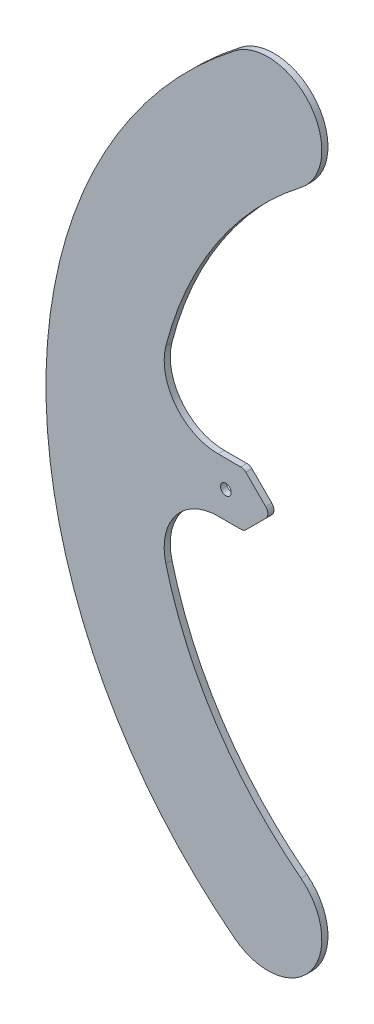
from build123d import *

# Parameters (mm, degrees)
SKETCH1_R           = 1.5
BOSS_EXTRUDE1_DEPTH = 1.7
FILLET1_R           = 15
FILLET2_R           = 2


with BuildPart() as part:
    # Sketch1 → Boss-Extrude1 (new body)
    with BuildSketch(Plane.XY):
        with BuildLine():
            ThreePointArc((-11.978690547, -106.87499991), (9.060608653, -104.164298748), (6.349906949, -83.124999619))
            ThreePointArc((6.349906949, -83.124999619), (-22.020584843, -49.648176002), (-34.231800328, -7.5))
            Line((-34.231800328, -7.5), (-9.5, -7.5))
            Line((-9.5, -7.5), (-2, 0))
            Line((-2, 0), (-9.5, 7.5))
            Line((-9.5, 7.5), (-34.231800328, 7.5))
            ThreePointArc((-34.231800328, 7.5), (-22.020584884, 49.648175925), (6.349906811, 83.124999512))
            ThreePointArc((6.349906811, 83.124999512), (9.060608694, 104.164298694), (-11.978690577, 106.874999887))
            ThreePointArc((-11.978690577, 106.874999887), (-64.5, -1.9e-08), (-11.978690547, -106.87499991))
        make_face()
        with Locations((-14.5, 0)):
            Circle(SKETCH1_R, mode=Mode.SUBTRACT)
    extrude(amount=BOSS_EXTRUDE1_DEPTH)

    # Fillet1
    fillet1_edges = [part.edges().sort_by_distance(p)[0] for p in [
        (-34.231800328, -7.5, 0.85),
        (-34.231800328, 7.5, 0.85),
    ]]
    fillet(fillet1_edges, radius=FILLET1_R)

    # Fillet2
    fillet2_edges = [part.edges().sort_by_distance(p)[0] for p in [
        (-9.5, 7.5, 0.85),
        (-2, 0, 0.85),
        (-9.5, -7.5, 0.85),
    ]]
    fillet(fillet2_edges, radius=FILLET2_R)


solid = part.part
